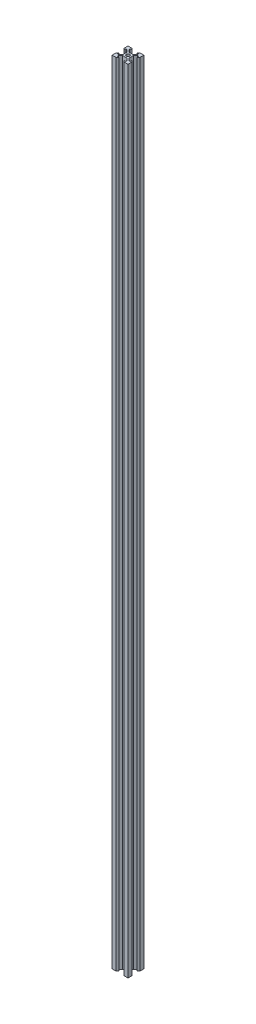
from build123d import *

# Parameters (mm, degrees)
SCHIZZO1_2_R                 = 2.1
ESTRUSIONE_ESTRUSIONE2_DEPTH = 1000


with BuildPart() as part:
    # Schizzo1<2> → Estrusione-Estrusione2 (new body)
    with BuildSketch(Plane(origin=(0, 0, 0), x_dir=(1, 0, 0), z_dir=(0, 1, 0))):
        Polygon((-10, 10), (-4.9, 10), (-3.1, 8.2), (-5.499339828, 8.2), (-5.499339828, 6.56), (-2.84, 3.900660172), (0, 3.900660172), (2.84, 3.900660172), (5.499339828, 6.56), (5.499339828, 8.2), (3.1, 8.2), (4.9, 10), (10, 10), (10, 4.9), (8.2, 3.1), (8.2, 5.499339828), (6.56, 5.499339828), (3.900660172, 2.84), (3.900660172, 0), (3.900660172, -2.84), (6.56, -5.499339828), (8.2, -5.499339828), (8.2, -3.1), (10, -4.9), (10, -10), (4.9, -10), (3.1, -8.2), (5.499339828, -8.2), (5.499339828, -6.56), (2.84, -3.900660172), (0, -3.900660172), (-2.84, -3.900660172), (-5.499339828, -6.56), (-5.499339828, -8.2), (-3.1, -8.2), (-4.9, -10), (-10, -10), (-10, -4.9), (-8.2, -3.1), (-8.2, -5.499339828), (-6.56, -5.499339828), (-3.900660172, -2.84), (-3.900660172, 0), (-3.900660172, 2.84), (-6.56, 5.499339828), (-8.2, 5.499339828), (-8.2, 3.1), (-10, 4.9), align=None)
        Circle(SCHIZZO1_2_R, mode=Mode.SUBTRACT)
    extrude(amount=ESTRUSIONE_ESTRUSIONE2_DEPTH)


solid = part.part
